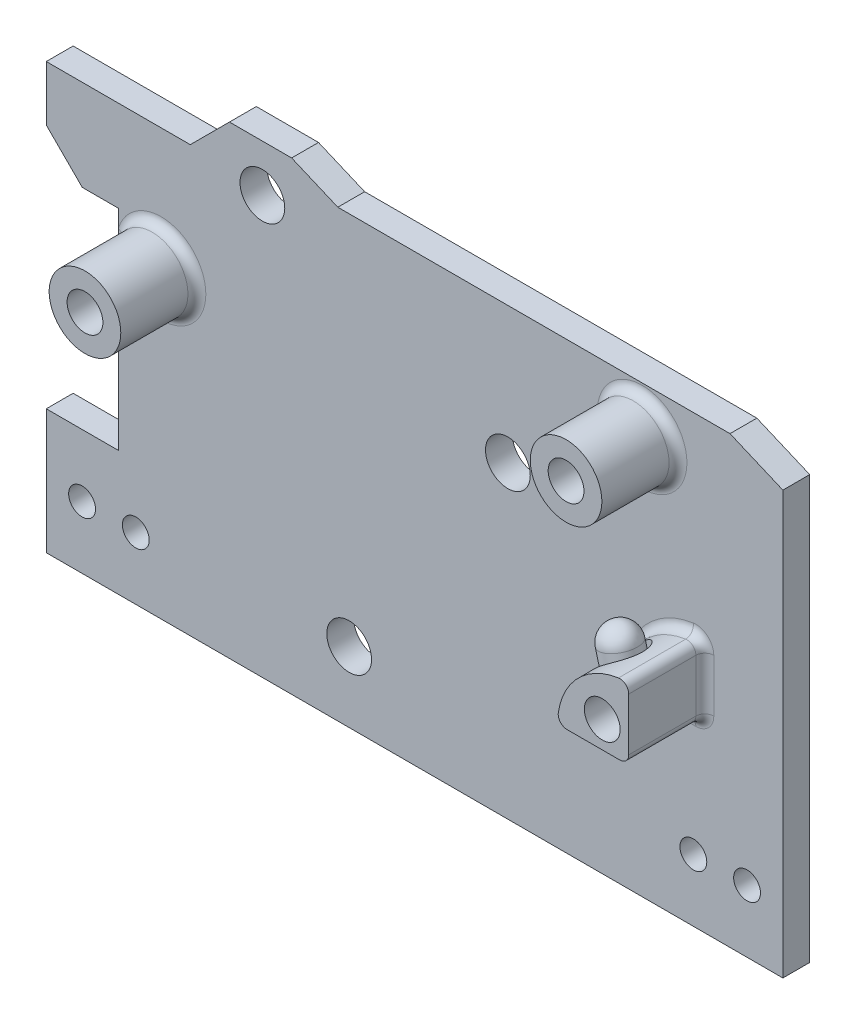
from build123d import *

# Parameters (mm, degrees)
SKETCH_2_R          = 2.5
SKETCH_2_R_2        = 4
EXTRUDE_1_DEPTH     = 3
SKETCH_2_3_R        = 2
SKETCH_2_3_R_2      = 4
EXTRUDE_2_DEPTH     = 11.5
SKETCH_6_R          = 2
EXTRUDE_3_DEPTH     = 2.3
FILLET_1_R          = 2
SKETCH_7_R          = 2.5
SKETCH_7_R_2        = 2
CUT_EXTRUDE_2_DEPTH = 2
FILLET_2_R          = 1
CUT_EXTRUDE_3_REACH = 51.374
SKETCH_8_R          = 1.5
CUT_EXTRUDE_4_REACH = 51.374
SKETCH_11_R         = 1.5


with BuildPart() as part:
    # 스케치2 → 보스-돌출1 (new body)
    with BuildSketch(Plane.XY):
        Polygon((-25.053133429, 21.570131373), (-41.138288377, 21.570131373), (-41.138288377, 15.425110404), (-37.11699964, 11.403821667), (-33.095710903, 11.403821667), (-33.095710903, -12.020899542), (-41.138288377, -12.020899542), (-41.138288377, -25.94560961), (41.138288377, -25.94560961), (41.138288377, 21.251065018), (35.231937864, 23.757870491), (-8.574109119, 23.757870491), (-13.728698976, 25.94560961), (-20.677655191, 25.94560961), align=None)
        with Locations((-7.306059133, -18.107570273)):
            Circle(SKETCH_2_R, mode=Mode.SUBTRACT)
        with BuildLine():
            Line((31.421946091, -5.467040421), (25.543402205, -5.467040421))
            ThreePointArc((25.543402205, -5.467040421), (24.78713928, -5.121308248), (24.553805205, -4.323173199))
            ThreePointArc((24.553805205, -4.323173199), (26.799843583, 0.155062087), (31.278078869, 2.401100465))
            ThreePointArc((31.278078869, 2.401100465), (32.076213917, 2.167766389), (32.421946091, 1.411503465))
            Line((32.421946091, 1.411503465), (32.421946091, -4.467040421))
            ThreePointArc((32.421946091, -4.467040421), (32.129052872, -5.174147202), (31.421946091, -5.467040421))
        make_face(mode=Mode.SUBTRACT)
        with Locations((-28.314407571, 7.976729123)):
            Circle(SKETCH_2_R_2, mode=Mode.SUBTRACT)
        with Locations((-17, 20.7)):
            Circle(SKETCH_2_R, mode=Mode.SUBTRACT)
        with Locations((10.421946091, 8.532959579)):
            Circle(SKETCH_2_R, mode=Mode.SUBTRACT)
        with Locations((25.421946091, 18.532959579)):
            Circle(SKETCH_2_R_2, mode=Mode.SUBTRACT)
    extrude(amount=EXTRUDE_1_DEPTH)

    # 스케치2<3> → 보스-돌출2 (add)
    # profile 1 of 3: a face of its own
    with BuildSketch(Plane.XY):
        with BuildLine():
            ThreePointArc((24.553805205, -4.323173199), (24.78713928, -5.121308248), (25.543402205, -5.467040421))
            Line((25.543402205, -5.467040421), (31.421946091, -5.467040421))
            ThreePointArc((31.421946091, -5.467040421), (32.129052872, -5.174147202), (32.421946091, -4.467040421))
            Line((32.421946091, -4.467040421), (32.421946091, 1.411503465))
            ThreePointArc((32.421946091, 1.411503465), (32.076213917, 2.167766389), (31.278078869, 2.401100465))
            ThreePointArc((31.278078869, 2.401100465), (26.799843583, 0.155062087), (24.553805205, -4.323173199))
        make_face()
        with Locations((29.464448227, -2.509542558)):
            Circle(SKETCH_2_3_R, mode=Mode.SUBTRACT)
    # profile 2 of 3: a face of its own
    with BuildSketch(Plane.XY):
        with Locations((-28.314407571, 7.976729123)):
            Circle(SKETCH_2_3_R_2)
        with Locations((-28.314407571, 7.976729123)):
            Circle(SKETCH_2_3_R, mode=Mode.SUBTRACT)
    # profile 3 of 3: a face of its own
    with BuildSketch(Plane.XY):
        with Locations((25.421946091, 18.532959579)):
            Circle(SKETCH_2_3_R_2)
        with Locations((25.421946091, 18.532959579)):
            Circle(SKETCH_2_3_R, mode=Mode.SUBTRACT)
    extrude(amount=EXTRUDE_2_DEPTH)

    # 스케치6 → 보스-돌출3 (add, symmetric)
    with BuildSketch(Plane(origin=(1.480786333, -5.526369829, 0), x_dir=(0, 0, 1), z_dir=(-0.25881904510252574, 0.9659258262890671, 0))):
        with Locations((7.25, 26.715994864)):
            Circle(SKETCH_6_R)
    extrude(amount=EXTRUDE_3_DEPTH, both=True)

    # 필렛1
    fillet_1_edges = [part.edges().sort_by_distance(p)[0] for p in [
        (26.691171943, 3.609867851, 5.25),
    ]]
    fillet(fillet_1_edges, radius=FILLET_1_R)

    # 스케치7 → 컷-돌출2 (cut)
    with BuildSketch(Plane(origin=(1.480786333, -5.526369829, 0), x_dir=(0, 0, 1), z_dir=(-0.25881904510252574, 0.9659258262890671, 0))):
        with Locations((7.25, 26.715994864)):
            Circle(SKETCH_7_R)
        with Locations((7.25, 26.715994864)):
            Circle(SKETCH_7_R_2, mode=Mode.SUBTRACT)
    extrude(amount=-CUT_EXTRUDE_2_DEPTH, mode=Mode.SUBTRACT)

    # 필렛2
    fillet_2_edges = [part.edges().sort_by_distance(p)[0] for p in [
        (32.076213917, 2.167766389, 3),
        (32.421946091, -1.527768478, 3),
        (32.129052872, -5.174147202, 3),
        (28.482674148, -5.467040421, 3),
        (24.78713928, -5.121308248, 3),
        (-32.314407571, 7.976729123, 3),
        (21.421946091, 18.532959579, 3),
        (26.799843583, 0.155062087, 3),
    ]]
    fillet(fillet_2_edges, radius=FILLET_2_R)

    # 스케치8 → 컷-돌출3 (cut, up to next)
    with BuildSketch(Plane.XY.offset(3), mode=Mode.PRIVATE) as cut_extrude_3_sk1:
        with Locations((-37.138288377, -18.983254576)):
            Circle(SKETCH_8_R)
    cut_extrude_3_tool1 = extrude(cut_extrude_3_sk1.sketch, amount=-CUT_EXTRUDE_3_REACH, mode=Mode.PRIVATE) & part.part
    # 스케치8 → 컷-돌출3 (cut, up to next)
    with BuildSketch(Plane.XY.offset(3), mode=Mode.PRIVATE) as cut_extrude_3_sk2:
        with Locations((-31.138288377, -18.983254576)):
            Circle(SKETCH_8_R)
    cut_extrude_3_tool2 = extrude(cut_extrude_3_sk2.sketch, amount=-CUT_EXTRUDE_3_REACH, mode=Mode.PRIVATE) & part.part
    add(cut_extrude_3_tool1.solids().sort_by_distance((-37.138288, -18.983255, 3))[0], mode=Mode.SUBTRACT)
    add(cut_extrude_3_tool2.solids().sort_by_distance((-31.138288, -18.983255, 3))[0], mode=Mode.SUBTRACT)

    # 스케치11 → 컷-돌출4 (cut, up to next)
    with BuildSketch(Plane.XY.offset(3), mode=Mode.PRIVATE) as cut_extrude_4_sk1:
        with Locations((37.138288377, -18.983254576)):
            Circle(SKETCH_11_R)
    cut_extrude_4_tool1 = extrude(cut_extrude_4_sk1.sketch, amount=-CUT_EXTRUDE_4_REACH, mode=Mode.PRIVATE) & part.part
    # 스케치11 → 컷-돌출4 (cut, up to next)
    with BuildSketch(Plane.XY.offset(3), mode=Mode.PRIVATE) as cut_extrude_4_sk2:
        with Locations((31.138288377, -18.983254576)):
            Circle(SKETCH_11_R)
    cut_extrude_4_tool2 = extrude(cut_extrude_4_sk2.sketch, amount=-CUT_EXTRUDE_4_REACH, mode=Mode.PRIVATE) & part.part
    add(cut_extrude_4_tool1.solids().sort_by_distance((37.138288, -18.983255, 3))[0], mode=Mode.SUBTRACT)
    add(cut_extrude_4_tool2.solids().sort_by_distance((31.138288, -18.983255, 3))[0], mode=Mode.SUBTRACT)


solid = part.part
